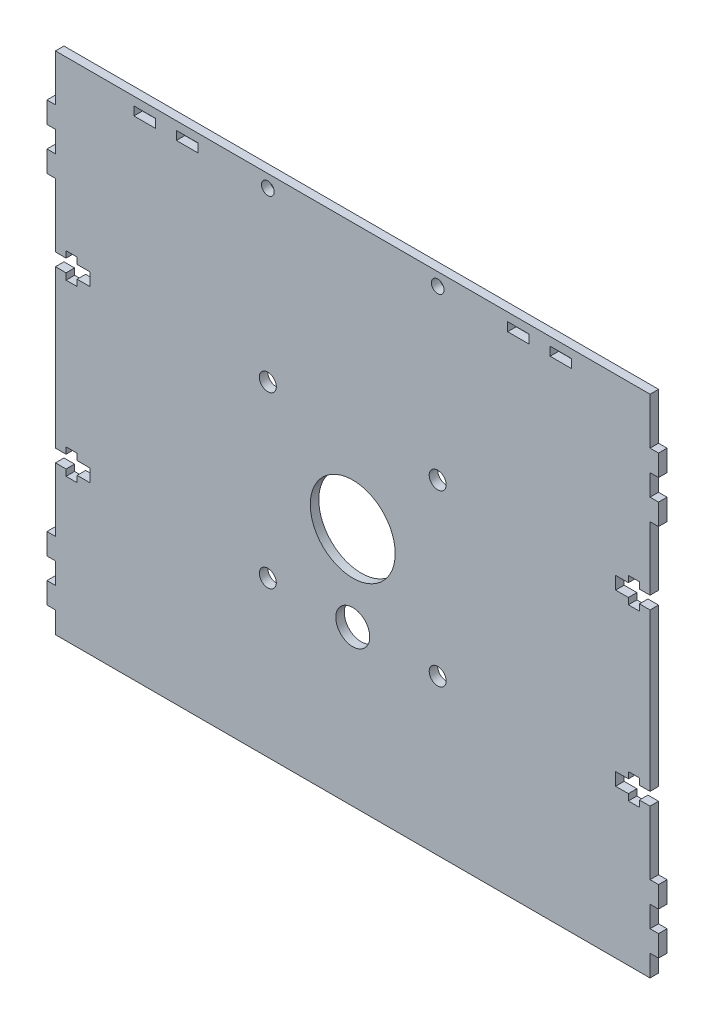
from build123d import *

# Parameters (mm, degrees)
SKETCH_1_R      = 10
SKETCH_1_R_2    = 4
SKETCH_1_R_3    = 1.5
SKETCH_1_R_4    = 2
SKETCH_1_W      = 5.05
SKETCH_1_H      = 2.05
EXTRUDE_1_DEPTH = 2


with BuildPart() as part:
    # 草图1 → 凸台-拉伸1 (new body)
    with BuildSketch(Plane.XY):
        Polygon((317.453360513, 257.462931603), (317.453360513, 258.962931603), (314.853360513, 258.962931603), (314.853360513, 257.462931603), (311.853360513, 257.462931603), (311.853360513, 254.462931603), (314.853360513, 254.462931603), (314.853360513, 252.962931603), (317.453360513, 252.962931603), (317.453360513, 254.462931603), (319.953360513, 254.462931603), (319.953360513, 239.462931603), (321.953360513, 239.462931603), (321.953360513, 234.462931603), (319.953360513, 234.462931603), (319.953360513, 229.462931603), (321.953360513, 229.462931603), (321.953360513, 224.462931603), (319.953360513, 224.462931603), (319.953360513, 219.413055772), (179.953360513, 219.413055772), (179.953360513, 224.462931603), (177.953360513, 224.462931603), (177.953360513, 229.462931603), (179.953360513, 229.462931603), (179.953360513, 234.462931603), (177.953360513, 234.462931603), (177.953360513, 239.462931603), (179.953360513, 239.462931603), (179.953360513, 254.462931603), (182.453360513, 254.462931603), (182.453360513, 252.962931602), (185.053360513, 252.962931602), (185.053360513, 254.462931603), (188.053360513, 254.462931603), (188.053360513, 257.462931603), (185.053360513, 257.462931603), (185.053360513, 258.962931602), (182.453360513, 258.962931602), (182.453360513, 257.462931603), (179.953360513, 257.462931603), (179.953360513, 294.462931603), (182.453360513, 294.462931603), (182.453360513, 292.962931603), (185.053360513, 292.962931603), (185.053360513, 294.462931603), (188.053360513, 294.462931603), (188.053360513, 297.462931603), (185.053360513, 297.462931603), (185.053360513, 298.962931603), (182.453360513, 298.962931603), (182.453360513, 297.462931603), (179.953360513, 297.462931603), (179.953360513, 312.462931603), (177.953360513, 312.462931603), (177.953360513, 317.462931603), (179.953360513, 317.462931603), (179.953360513, 322.462931603), (177.953360513, 322.462931603), (177.953360513, 327.462931603), (179.953360513, 327.462931603), (179.953360513, 338.462931603), (319.953360513, 338.462931603), (319.953360513, 327.462931603), (321.953360513, 327.462931603), (321.953360513, 322.462931603), (319.953360513, 322.462931603), (319.953360513, 317.462931603), (321.953360513, 317.462931603), (321.953360513, 312.462931603), (319.953360513, 312.462931603), (319.953360513, 297.462931603), (317.453360513, 297.462931603), (317.453360513, 298.962931603), (314.853360513, 298.962931603), (314.853360513, 297.462931603), (311.853360513, 297.462931603), (311.853360513, 294.462931603), (314.853360513, 294.462931603), (314.853360513, 292.962931603), (317.453360513, 292.962931603), (317.453360513, 294.462931603), (319.953360513, 294.462931603), (319.953360513, 257.462931603), align=None)
        with Locations((249.953360513, 275.962931603)):
            Circle(SKETCH_1_R, mode=Mode.SUBTRACT)
        with Locations((249.953360513, 255.962931603)):
            Circle(SKETCH_1_R_2, mode=Mode.SUBTRACT)
        with Locations((229.953360513, 335.462931603)):
            Circle(SKETCH_1_R_3, mode=Mode.SUBTRACT)
        with Locations((269.953360513, 335.462931603)):
            Circle(SKETCH_1_R_3, mode=Mode.SUBTRACT)
        with Locations((229.953360513, 255.962931603)):
            Circle(SKETCH_1_R_4, mode=Mode.SUBTRACT)
        with Locations((229.953360513, 295.962931603)):
            Circle(SKETCH_1_R_4, mode=Mode.SUBTRACT)
        with Locations((269.953360513, 295.962931603)):
            Circle(SKETCH_1_R_4, mode=Mode.SUBTRACT)
        with Locations((269.953360513, 255.962931603)):
            Circle(SKETCH_1_R_4, mode=Mode.SUBTRACT)
        with Locations((288.953360513, 335.462931603)):
            Rectangle(SKETCH_1_W, SKETCH_1_H, mode=Mode.SUBTRACT)
        with Locations((298.953360513, 335.462931603)):
            Rectangle(SKETCH_1_W, SKETCH_1_H, mode=Mode.SUBTRACT)
        with Locations((200.953360513, 335.462931603)):
            Rectangle(SKETCH_1_W, SKETCH_1_H, mode=Mode.SUBTRACT)
        with Locations((210.953360513, 335.462931603)):
            Rectangle(SKETCH_1_W, SKETCH_1_H, mode=Mode.SUBTRACT)
    extrude(amount=EXTRUDE_1_DEPTH)


solid = part.part
